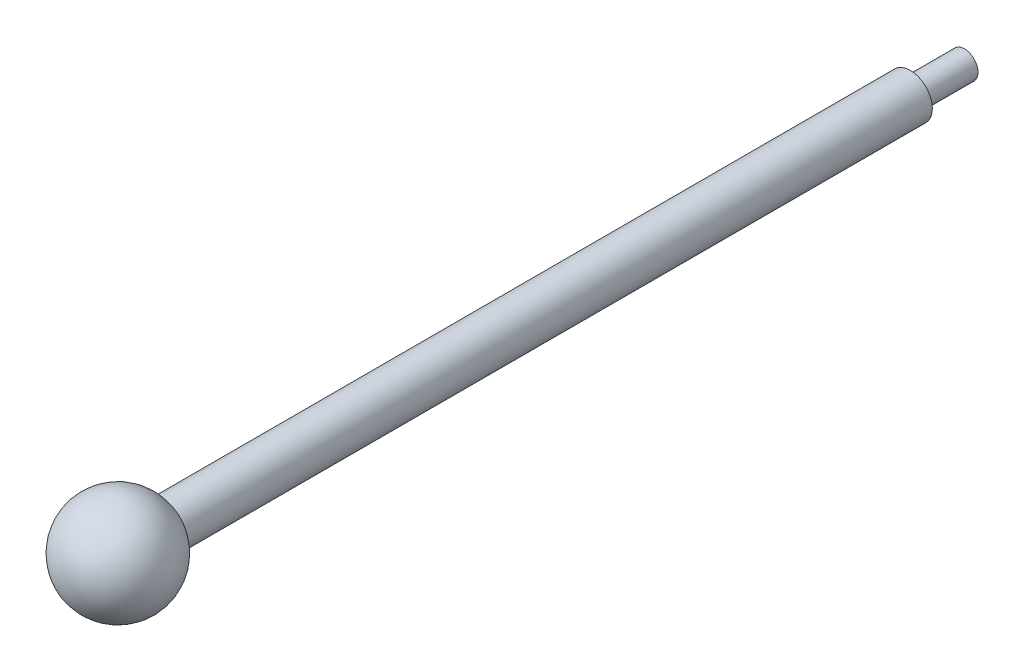
from build123d import *

# Parameters (mm, degrees)
SZKIC2_R                                = 6.5
DODANIE_WYCI_GNI_CIE1_DEPTH             = 219
DODANIE_WYCI_GNI_CIE1_DIRECTION_2_REACH = 38.742
SZKIC3_R                                = 4
DODANIE_WYCI_GNI_CIE2_DEPTH             = 16


with BuildPart() as part:
    # Szkic1 → Obrót5 (revolve)
    with BuildSketch(Plane.XY):
        with BuildLine():
            Line((0, 15), (0, -15))
            ThreePointArc((0, -15), (-15, 0), (0, 15))
        make_face()
    revolve(axis=Axis((0, 15, 0), (0, -1, 0)))

    # Szkic2 → Dodanie-wyciągnięcie1 (add)
    with BuildSketch(Plane(origin=(0, 0, -15), x_dir=(-1, 0, 0), z_dir=(0, 0, -1))):
        Circle(SZKIC2_R)
    extrude(amount=DODANIE_WYCI_GNI_CIE1_DEPTH)

    # Szkic2 → Dodanie-wyciągnięcie1 direction 2 (add, up to next)
    with BuildSketch(Plane(origin=(0, 0, -15), x_dir=(-1, 0, 0), z_dir=(0, 0, -1)), mode=Mode.PRIVATE) as dodanie_wyci_gni_cie1_direction_2_sk1:
        Circle(SZKIC2_R)
    dodanie_wyci_gni_cie1_direction_2_tool1 = extrude(dodanie_wyci_gni_cie1_direction_2_sk1.sketch, amount=-DODANIE_WYCI_GNI_CIE1_DIRECTION_2_REACH, mode=Mode.PRIVATE) - part.part
    add(dodanie_wyci_gni_cie1_direction_2_tool1.solids().sort_by_distance((0, 0, -15))[0])

    # Szkic3 → Dodanie-wyciągnięcie2 (add)
    with BuildSketch(Plane(origin=(0, 0, -234), x_dir=(-1, 0, 0), z_dir=(0, 0, -1))):
        Circle(SZKIC3_R)
    extrude(amount=DODANIE_WYCI_GNI_CIE2_DEPTH)


solid = part.part
